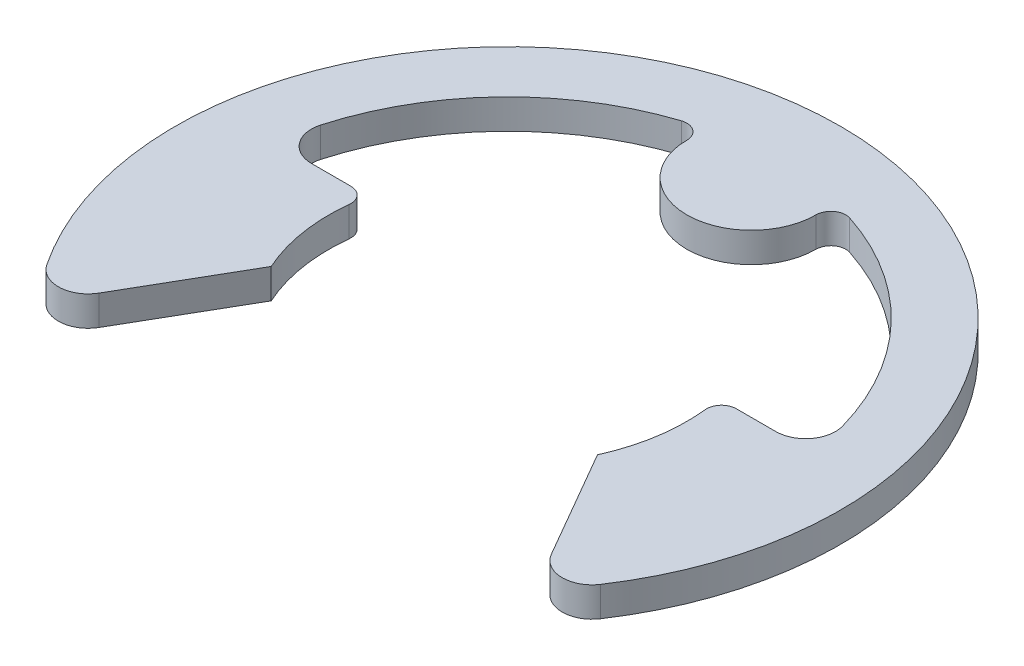
from build123d import *

# Parameters (mm, degrees)
EXTRUDE_1_DEPTH = 2


with BuildPart() as part:
    # 草图1 → 凸台-拉伸1 (new body)
    with BuildSketch(Plane(origin=(0, 0, 0), x_dir=(1, 0, 0), z_dir=(0, 1, 0))):
        with BuildLine():
            Line((12.924395537, 2.4), (15.570240846, 2.4))
            ThreePointArc((15.570240846, 2.4), (17.165195809, 3.193302579), (17.494868886, 4.943881335))
            ThreePointArc((17.494868886, 4.943881335), (13.110639725, 12.594583201), (5.642066631, 17.282346025))
            ThreePointArc((5.642066631, 17.282346025), (4.744501657, 17.141149105), (4.331721931, 16.331721931))
            ThreePointArc((4.331721931, 16.331721931), (0, 12), (-4.331721931, 16.331721931))
            ThreePointArc((-4.331721931, 16.331721931), (-4.744501657, 17.141149105), (-5.642066631, 17.282346025))
            ThreePointArc((-5.642066631, 17.282346025), (-13.110639725, 12.594583201), (-17.494868886, 4.943881335))
            ThreePointArc((-17.494868886, 4.943881335), (-17.165195809, 3.193302579), (-15.570240846, 2.4))
            Line((-15.570240846, 2.4), (-12.924395537, 2.4))
            ThreePointArc((-12.924395537, 2.4), (-12.18018713, 2.067947488), (-11.930211265, 1.292307692))
            ThreePointArc((-11.930211265, 1.292307692), (-11.850930243, -1.885590724), (-10.94, -4.931166191))
            Line((-10.94, -4.931166191), (-15.165520228, -12.249981915))
            ThreePointArc((-15.165520228, -12.249981915), (-16.833795519, -13.248964827), (-18.56235636, -12.358354517))
            ThreePointArc((-18.56235636, -12.358354517), (0, 22.3), (18.56235636, -12.358354517))
            ThreePointArc((18.56235636, -12.358354517), (16.833795519, -13.248964827), (15.165520228, -12.249981915))
            Line((15.165520228, -12.249981915), (10.94, -4.931166191))
            ThreePointArc((10.94, -4.931166191), (11.850930243, -1.885590724), (11.930211265, 1.292307692))
            ThreePointArc((11.930211265, 1.292307692), (12.18018713, 2.067947488), (12.924395537, 2.4))
        make_face()
    extrude(amount=EXTRUDE_1_DEPTH)


solid = part.part
